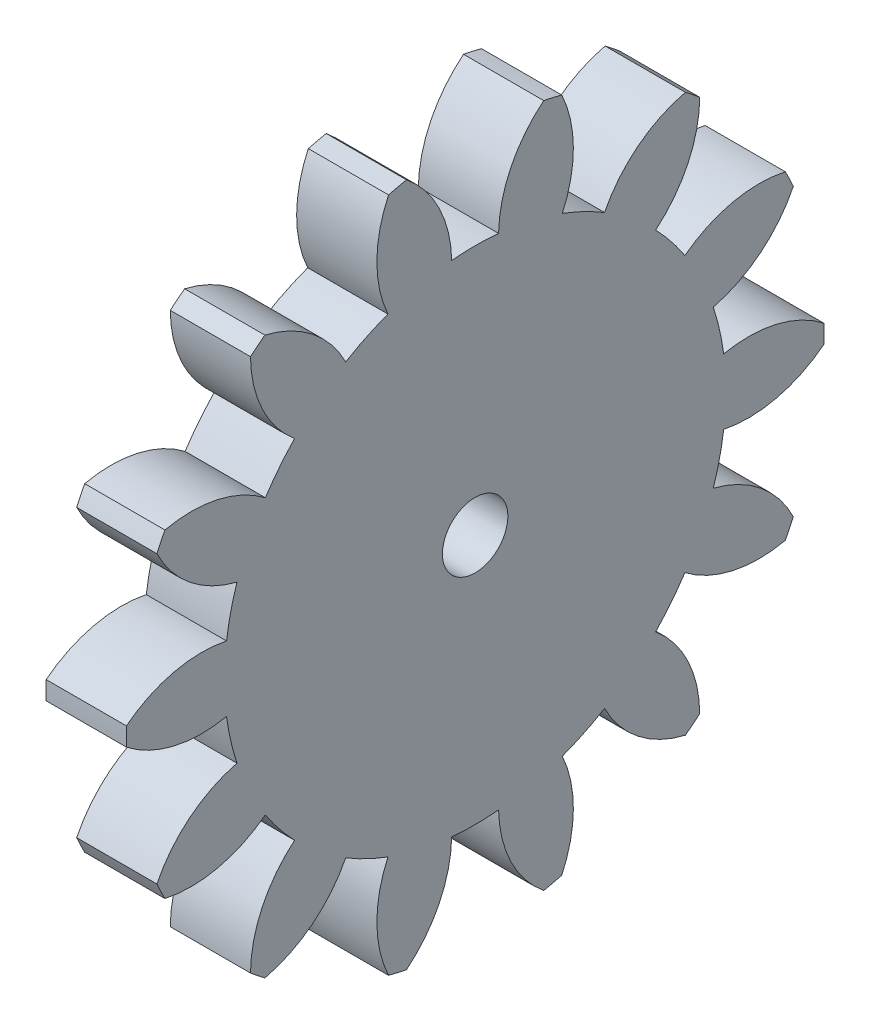
from build123d import *

# Parameters (mm, degrees)
BASPROSKE_W     = 5.842
BASPROSKE_H     = 25.4
TOOTHCUT_DEPTH  = 37.392979598
TEETHCUTS_COUNT = 14
TEETHCUTS_ANGLE = 334.285714286
BORSKE_R        = 2.38125
BORE_DEPTH      = 50.8000508


with BuildPart() as part:
    # BasProSke → Base-Revolve (revolve)
    with BuildSketch(Plane(origin=(0, 0, 0), x_dir=(1, 0, 0), z_dir=(0, 1, 0)), mode=Mode.PRIVATE) as base_revolve_sk:
        with Locations((2.921, 12.7)):
            Rectangle(BASPROSKE_W, BASPROSKE_H)
    revolve(base_revolve_sk.sketch.rotate(Axis((-10, 0, 0), (1, 0, 0)), 180), axis=Axis((-10, 0, 0), (1, 0, 0)))

    # TooCutSke → ToothCut (cut, through all)
    with BuildSketch(Plane(origin=(0, 0, 0), x_dir=(0, 0, -1), z_dir=(1, 0, 0))):
        with BuildLine():
            ThreePointArc((1.706651822, 18.175027768), (0, 18.25498), (-1.706651822, 18.175027768))
            ThreePointArc((-1.706651822, 18.175027768), (-2.615732733, 21.917571043), (-5.022372322, 24.924420584))
            ThreePointArc((-5.022372322, 24.924420584), (0, 25.4254), (5.022372322, 24.924420584))
            ThreePointArc((5.022372322, 24.924420584), (2.615732733, 21.917571043), (1.706651822, 18.175027768))
        make_face()
    toothcut = extrude(amount=TOOTHCUT_DEPTH, mode=Mode.SUBTRACT)

    # TeethCuts: ToothCut ×14 about axis
    teethcuts_axis = Axis((-10, 0, 0), (1, 0, 0))
    for i in range(1, TEETHCUTS_COUNT):
        add(toothcut.rotate(teethcuts_axis, i * TEETHCUTS_ANGLE / (TEETHCUTS_COUNT - 1)), mode=Mode.SUBTRACT)

    # BorSke → Bore (cut, symmetric)
    with BuildSketch(Plane(origin=(0, 0, 0), x_dir=(0, 0, -1), z_dir=(1, 0, 0))):
        with Locations(Location((0, 0, 0), (0, 0, 180))):
            Circle(BORSKE_R)
    extrude(amount=BORE_DEPTH, both=True, mode=Mode.SUBTRACT)


solid = part.part
